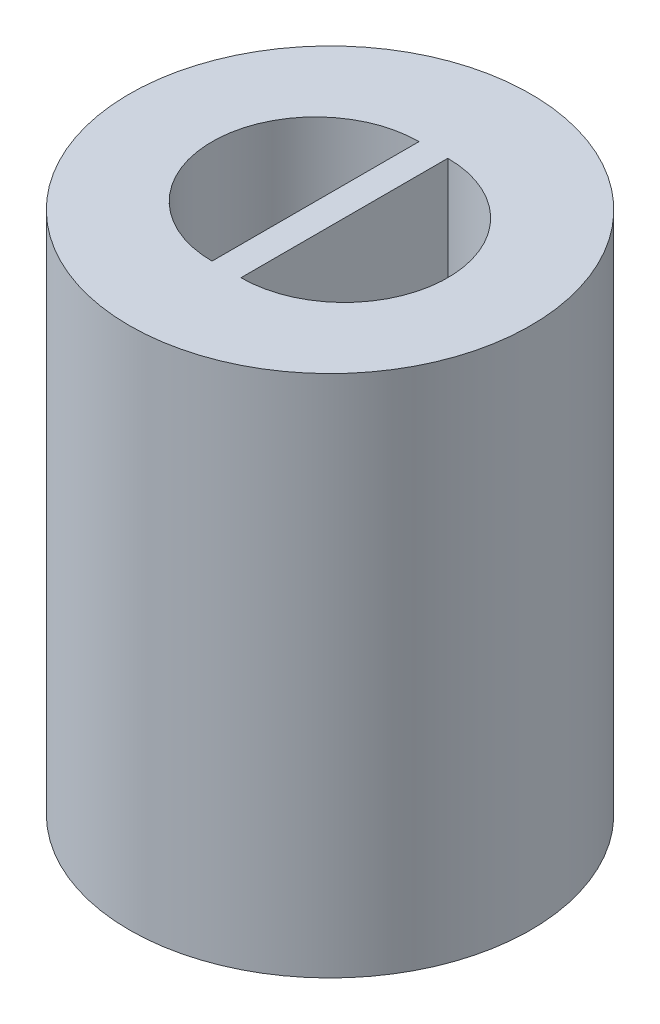
from build123d import *

# Parameters (mm, degrees)
SKETCH1_R           = 5.75
BOSS_EXTRUDE1_DEPTH = 15
CUT_EXTRUDE3_DEPTH  = 8
SKETCH7_R           = 1
CUT_EXTRUDE4_DEPTH  = 6.5


with BuildPart() as part:
    # Sketch1 → Boss-Extrude1 (new body)
    with BuildSketch(Plane(origin=(0, 0, 0), x_dir=(1, 0, 0), z_dir=(0, 1, 0))):
        with Locations(Location((0, 0, 0), (0, 0, 270))):
            Circle(SKETCH1_R)
    extrude(amount=BOSS_EXTRUDE1_DEPTH)

    # Sketch6 → Cut-Extrude3 (cut)
    with BuildSketch(Plane(origin=(0, 15, 0), x_dir=(1, 0, 0), z_dir=(0, 1, 0))):
        with BuildLine():
            Line((0.41, 2.964671599), (0.41, -2.964671599))
            ThreePointArc((0.41, -2.964671599), (3.374671599, 0), (0.41, 2.964671599))
        make_face()
        with BuildLine():
            Line((-0.416408681, 2.965564682), (-0.416408681, -2.965564682))
            ThreePointArc((-0.416408681, -2.965564682), (-3.381973363, 0), (-0.416408681, 2.965564682))
        make_face()
    extrude(amount=-CUT_EXTRUDE3_DEPTH, mode=Mode.SUBTRACT)

    # Sketch7 → Cut-Extrude4 (cut)
    with BuildSketch(Plane(origin=(0, 0, 0), x_dir=(1, 0, 0), z_dir=(0, 1, 0))):
        with Locations(Location((0, 0, 0), (0, 0, 90))):
            Circle(SKETCH7_R)
    extrude(amount=CUT_EXTRUDE4_DEPTH, mode=Mode.SUBTRACT)


solid = part.part
